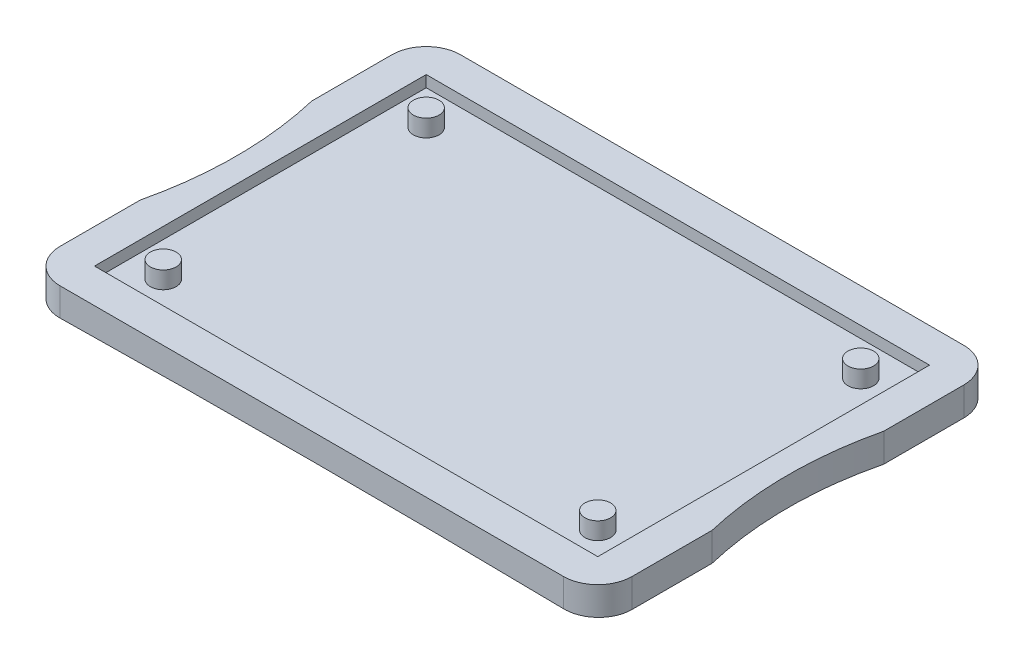
from build123d import *

# Parameters (mm, degrees)
BOSS_EXTRUDE1_DEPTH     = 2.5
CUT_EXTRUDE1_DEPTH      = 31.618621785
CUT_EXTRUDE1_DEPTH_BACK = 31.618621785
SKETCH3_W               = 44
SKETCH3_H               = 29
SKETCH3_R               = 1.125
CUT_EXTRUDE2_DEPTH      = 1
BOSS_EXTRUDE2_START     = 0.5
SKETCH3_5_R             = 1.125
BOSS_EXTRUDE2_DEPTH     = 0.5


with BuildPart() as part:
    # Sketch1 → Boss-Extrude1 (new body)
    with BuildSketch(Plane(origin=(0, 0, 0), x_dir=(1, 0, 0), z_dir=(0, 1, 0))):
        with BuildLine():
            Line((22, 17.5), (-22, 17.5))
            ThreePointArc((-22, 17.5), (-24.121320344, 16.621320344), (-25, 14.5))
            Line((-25, 14.5), (-25, 7.5))
            ThreePointArc((-25, 7.5), (-24.12566565, 0), (-25, -7.5))
            Line((-25, -7.5), (-25, -14.5))
            ThreePointArc((-25, -14.5), (-24.121320344, -16.621320344), (-22, -17.5))
            Line((-22, -17.5), (22, -17.5))
            ThreePointArc((22, -17.5), (24.121320344, -16.621320344), (25, -14.5))
            Line((25, -14.5), (25, -7.5))
            ThreePointArc((25, -7.5), (24.12566565, 0), (25, 7.5))
            Line((25, 7.5), (25, 14.5))
            ThreePointArc((25, 14.5), (24.121320344, 16.621320344), (22, 17.5))
        make_face()
    extrude(amount=-BOSS_EXTRUDE1_DEPTH)

    # Sketch2 → Cut-Extrude1 (cut, two sides: drawn at the far end of the back side and taken through both)
    with BuildSketch(Plane.XY.offset(-CUT_EXTRUDE1_DEPTH_BACK)):
        with BuildLine():
            Line((-25, -2.5), (25, -2.5))
            ThreePointArc((25, -2.5), (0, -2.25), (-25, -2.5))
        make_face()
    extrude(amount=CUT_EXTRUDE1_DEPTH + CUT_EXTRUDE1_DEPTH_BACK, mode=Mode.SUBTRACT)

    # Sketch3 → Cut-Extrude2 (cut)
    with BuildSketch(Plane(origin=(0, 0, 0), x_dir=(1, 0, 0), z_dir=(0, 1, 0))):
        Rectangle(SKETCH3_W, SKETCH3_H)
        with Locations((-18.99479618, -11.49479618)):
            Circle(SKETCH3_R, mode=Mode.SUBTRACT)
        with Locations((18.99479618, -11.49479618)):
            Circle(SKETCH3_R, mode=Mode.SUBTRACT)
        with BuildLine():
            ThreePointArc((-17.86979618, 11.49479618), (-19.425315041, 10.455431706), (-19.790291309, 12.290291309))
            ThreePointArc((-19.790291309, 12.290291309), (-18.564277319, 12.534160654), (-17.86979618, 11.49479618))
        make_face(mode=Mode.SUBTRACT)
        with Locations((18.99479618, 11.49479618)):
            Circle(SKETCH3_R, mode=Mode.SUBTRACT)
    extrude(amount=-CUT_EXTRUDE2_DEPTH, mode=Mode.SUBTRACT)

    # Sketch3<5> → Boss-Extrude2 (add)
    with BuildSketch(Plane(origin=(0, 0, 0), x_dir=(1, 0, 0), z_dir=(0, 1, 0)).offset(BOSS_EXTRUDE2_START)):
        with Locations((-18.99479618, 11.49479618)):
            Circle(SKETCH3_5_R)
        with Locations((18.99479618, 11.49479618)):
            Circle(SKETCH3_5_R)
        with Locations((18.99479618, -11.49479618)):
            Circle(SKETCH3_5_R)
        with Locations((-18.99479618, -11.49479618)):
            Circle(SKETCH3_5_R)
    extrude(amount=-BOSS_EXTRUDE2_DEPTH)


solid = part.part
